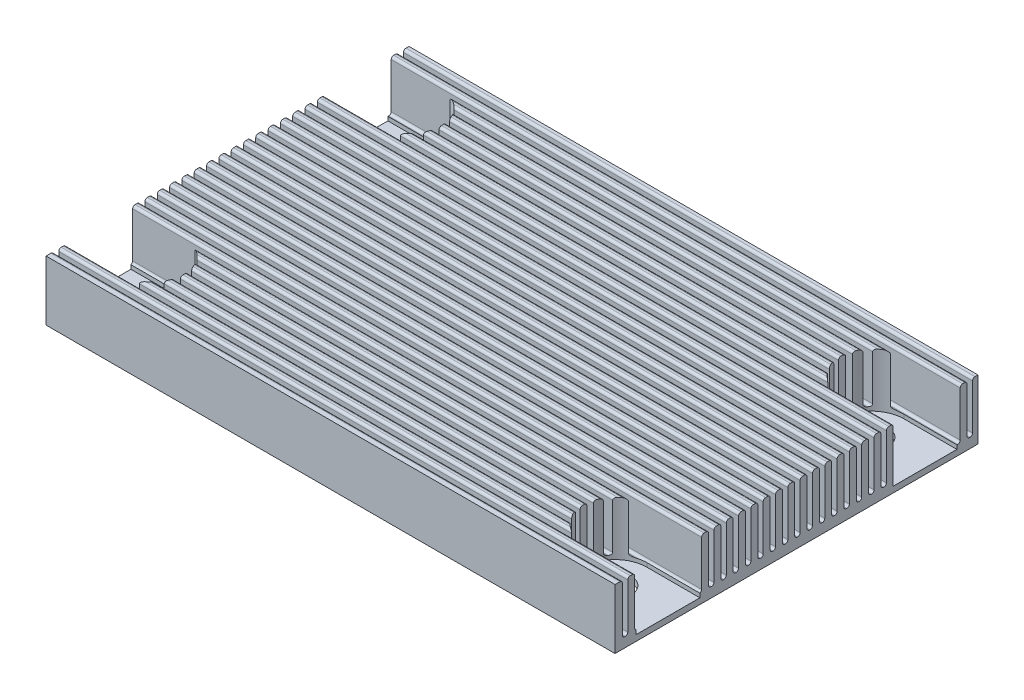
from build123d import *

# Parameters (mm, degrees)
SKETCH1_W           = 58
SKETCH1_H           = 37
SKETCH1_R           = 1.65
BOSS_EXTRUDE1_DEPTH = 6.1
CUT_EXTRUDE1_DEPTH  = 62.183821391
CUT_EXTRUDE3_START  = -5.5
SKETCH3_R           = 3.25
CUT_EXTRUDE3_DEPTH  = 5.5


with BuildPart() as part:
    # Sketch1 → Boss-Extrude1 (new body)
    with BuildSketch(Plane(origin=(0, 0, 0), x_dir=(1, 0, 0), z_dir=(0, 1, 0))):
        Rectangle(SKETCH1_W, SKETCH1_H)
        with Locations(Location((-23.6, 13.1, 0), (0, 0, 270))):
            Circle(SKETCH1_R, mode=Mode.SUBTRACT)
        with Locations(Location((-23.6, -13.1, 0), (0, 0, 270))):
            Circle(SKETCH1_R, mode=Mode.SUBTRACT)
        with Locations(Location((23.6, -13.1, 0), (0, 0, 270))):
            Circle(SKETCH1_R, mode=Mode.SUBTRACT)
        with Locations(Location((23.6, 13.1, 0), (0, 0, 270))):
            Circle(SKETCH1_R, mode=Mode.SUBTRACT)
    extrude(amount=BOSS_EXTRUDE1_DEPTH)

    # Sketch2 → Cut-Extrude1 (cut, through all)
    with BuildSketch(Plane(origin=(29, 0, 0), x_dir=(0, 0, -1), z_dir=(1, 0, 0))):
        with BuildLine():
            Line((-11.68, 6.1), (-11.725, 6.1))
            ThreePointArc((-11.725, 6.1), (-11.548223305, 6.026776695), (-11.475, 5.85))
            Line((-11.475, 5.85), (-11.475, 1.25))
            ThreePointArc((-11.475, 1.25), (-11.401776695, 1.073223305), (-11.225, 1))
            Line((-11.225, 1), (-11.175, 1))
            ThreePointArc((-11.175, 1), (-10.998223305, 1.073223305), (-10.925, 1.25))
            Line((-10.925, 1.25), (-10.925, 5.85))
            ThreePointArc((-10.925, 5.85), (-10.851776695, 6.026776695), (-10.675, 6.1))
            Line((-10.675, 6.1), (-11.68, 6.1))
        make_face()
        with BuildLine():
            Line((-10.425, 6.1), (-10.47, 6.1))
            ThreePointArc((-10.47, 6.1), (-10.293223305, 6.026776695), (-10.22, 5.85))
            Line((-10.22, 5.85), (-10.22, 1.25))
            ThreePointArc((-10.22, 1.25), (-10.146776695, 1.073223305), (-9.97, 1))
            Line((-9.97, 1), (-9.92, 1))
            ThreePointArc((-9.92, 1), (-9.743223305, 1.073223305), (-9.67, 1.25))
            Line((-9.67, 1.25), (-9.67, 5.85))
            ThreePointArc((-9.67, 5.85), (-9.596776695, 6.026776695), (-9.42, 6.1))
            Line((-9.42, 6.1), (-10.425, 6.1))
        make_face()
        with BuildLine():
            Line((-9.17, 6.1), (-9.215, 6.1))
            ThreePointArc((-9.215, 6.1), (-9.038223305, 6.026776695), (-8.965, 5.85))
            Line((-8.965, 5.85), (-8.965, 1.25))
            ThreePointArc((-8.965, 1.25), (-8.891776695, 1.073223305), (-8.715, 1))
            Line((-8.715, 1), (-8.665, 1))
            ThreePointArc((-8.665, 1), (-8.488223305, 1.073223305), (-8.415, 1.25))
            Line((-8.415, 1.25), (-8.415, 5.85))
            ThreePointArc((-8.415, 5.85), (-8.341776695, 6.026776695), (-8.165, 6.1))
            Line((-8.165, 6.1), (-9.17, 6.1))
        make_face()
        with BuildLine():
            Line((-7.915, 6.1), (-7.96, 6.1))
            ThreePointArc((-7.96, 6.1), (-7.783223305, 6.026776695), (-7.71, 5.85))
            Line((-7.71, 5.85), (-7.71, 1.25))
            ThreePointArc((-7.71, 1.25), (-7.636776695, 1.073223305), (-7.46, 1))
            Line((-7.46, 1), (-7.41, 1))
            ThreePointArc((-7.41, 1), (-7.233223305, 1.073223305), (-7.16, 1.25))
            Line((-7.16, 1.25), (-7.16, 5.85))
            ThreePointArc((-7.16, 5.85), (-7.086776695, 6.026776695), (-6.91, 6.1))
            Line((-6.91, 6.1), (-7.915, 6.1))
        make_face()
        with BuildLine():
            Line((-6.66, 6.1), (-6.705, 6.1))
            ThreePointArc((-6.705, 6.1), (-6.528223305, 6.026776695), (-6.455, 5.85))
            Line((-6.455, 5.85), (-6.455, 1.25))
            ThreePointArc((-6.455, 1.25), (-6.381776695, 1.073223305), (-6.205, 1))
            Line((-6.205, 1), (-6.155, 1))
            ThreePointArc((-6.155, 1), (-5.978223305, 1.073223305), (-5.905, 1.25))
            Line((-5.905, 1.25), (-5.905, 5.85))
            ThreePointArc((-5.905, 5.85), (-5.831776695, 6.026776695), (-5.655, 6.1))
            Line((-5.655, 6.1), (-6.66, 6.1))
        make_face()
        with BuildLine():
            Line((-12.935, 6.1), (-12.98, 6.1))
            ThreePointArc((-12.98, 6.1), (-12.803223305, 6.026776695), (-12.73, 5.85))
            Line((-12.73, 5.85), (-12.73, 1.25))
            ThreePointArc((-12.73, 1.25), (-12.656776695, 1.073223305), (-12.48, 1))
            Line((-12.48, 1), (-12.43, 1))
            ThreePointArc((-12.43, 1), (-12.253223305, 1.073223305), (-12.18, 1.25))
            Line((-12.18, 1.25), (-12.18, 5.85))
            ThreePointArc((-12.18, 5.85), (-12.106776695, 6.026776695), (-11.93, 6.1))
            Line((-11.93, 6.1), (-12.935, 6.1))
        make_face()
        with BuildLine():
            Line((-14.19, 6.1), (-14.235, 6.1))
            ThreePointArc((-14.235, 6.1), (-14.058223305, 6.026776695), (-13.985, 5.85))
            Line((-13.985, 5.85), (-13.985, 1.25))
            ThreePointArc((-13.985, 1.25), (-13.911776695, 1.073223305), (-13.735, 1))
            Line((-13.735, 1), (-13.685, 1))
            ThreePointArc((-13.685, 1), (-13.508223305, 1.073223305), (-13.435, 1.25))
            Line((-13.435, 1.25), (-13.435, 5.85))
            ThreePointArc((-13.435, 5.85), (-13.361776695, 6.026776695), (-13.185, 6.1))
            Line((-13.185, 6.1), (-14.19, 6.1))
        make_face()
        with BuildLine():
            Line((-15.445, 6.1), (-15.49, 6.1))
            ThreePointArc((-15.49, 6.1), (-15.313223305, 6.026776695), (-15.24, 5.85))
            Line((-15.24, 5.85), (-15.24, 1.25))
            ThreePointArc((-15.24, 1.25), (-15.166776695, 1.073223305), (-14.99, 1))
            Line((-14.99, 1), (-14.94, 1))
            ThreePointArc((-14.94, 1), (-14.763223305, 1.073223305), (-14.69, 1.25))
            Line((-14.69, 1.25), (-14.69, 5.85))
            ThreePointArc((-14.69, 5.85), (-14.616776695, 6.026776695), (-14.44, 6.1))
            Line((-14.44, 6.1), (-15.445, 6.1))
        make_face()
        with BuildLine():
            ThreePointArc((-16.745, 6.1), (-16.568223305, 6.026776695), (-16.495, 5.85))
            Line((-16.495, 5.85), (-16.495, 1.25))
            ThreePointArc((-16.495, 1.25), (-16.421776695, 1.073223305), (-16.245, 1))
            Line((-16.245, 1), (-16.195, 1))
            ThreePointArc((-16.195, 1), (-16.018223305, 1.073223305), (-15.945, 1.25))
            Line((-15.945, 1.25), (-15.945, 5.85))
            ThreePointArc((-15.945, 5.85), (-15.871776695, 6.026776695), (-15.695, 6.1))
            Line((-15.695, 6.1), (-16.7, 6.1))
            Line((-16.7, 6.1), (-16.745, 6.1))
        make_face()
        with BuildLine():
            Line((-17.2, 5.85), (-17.75, 5.85))
            Line((-17.75, 5.85), (-17.75, 1.25))
            ThreePointArc((-17.75, 1.25), (-17.676776695, 1.073223305), (-17.5, 1))
            Line((-17.5, 1), (-17.45, 1))
            ThreePointArc((-17.45, 1), (-17.273223305, 1.073223305), (-17.2, 1.25))
            Line((-17.2, 1.25), (-17.2, 5.85))
        make_face()
        with BuildLine():
            ThreePointArc((-18, 6.1), (-17.823223305, 6.026776695), (-17.75, 5.85))
            Line((-17.75, 5.85), (-17.2, 5.85))
            ThreePointArc((-17.2, 5.85), (-17.126776695, 6.026776695), (-16.95, 6.1))
            Line((-16.95, 6.1), (-18, 6.1))
        make_face()
        with BuildLine():
            Line((-5.405, 6.1), (-5.45, 6.1))
            ThreePointArc((-5.45, 6.1), (-5.273223305, 6.026776695), (-5.2, 5.85))
            Line((-5.2, 5.85), (-5.2, 1.25))
            ThreePointArc((-5.2, 1.25), (-5.126776695, 1.073223305), (-4.95, 1))
            Line((-4.95, 1), (-4.9, 1))
            ThreePointArc((-4.9, 1), (-4.723223305, 1.073223305), (-4.65, 1.25))
            Line((-4.65, 1.25), (-4.65, 5.85))
            ThreePointArc((-4.65, 5.85), (-4.576776695, 6.026776695), (-4.4, 6.1))
            Line((-4.4, 6.1), (-5.405, 6.1))
        make_face()
        with BuildLine():
            Line((-4.15, 6.1), (-4.195, 6.1))
            ThreePointArc((-4.195, 6.1), (-4.018223305, 6.026776695), (-3.945, 5.85))
            Line((-3.945, 5.85), (-3.945, 1.25))
            ThreePointArc((-3.945, 1.25), (-3.871776695, 1.073223305), (-3.695, 1))
            Line((-3.695, 1), (-3.645, 1))
            ThreePointArc((-3.645, 1), (-3.468223305, 1.073223305), (-3.395, 1.25))
            Line((-3.395, 1.25), (-3.395, 5.85))
            ThreePointArc((-3.395, 5.85), (-3.321776695, 6.026776695), (-3.145, 6.1))
            Line((-3.145, 6.1), (-4.15, 6.1))
        make_face()
        with BuildLine():
            Line((-2.895, 6.1), (-2.94, 6.1))
            ThreePointArc((-2.94, 6.1), (-2.763223305, 6.026776695), (-2.69, 5.85))
            Line((-2.69, 5.85), (-2.69, 1.25))
            ThreePointArc((-2.69, 1.25), (-2.616776695, 1.073223305), (-2.44, 1))
            Line((-2.44, 1), (-2.39, 1))
            ThreePointArc((-2.39, 1), (-2.213223305, 1.073223305), (-2.14, 1.25))
            Line((-2.14, 1.25), (-2.14, 5.85))
            ThreePointArc((-2.14, 5.85), (-2.066776695, 6.026776695), (-1.89, 6.1))
            Line((-1.89, 6.1), (-2.895, 6.1))
        make_face()
        with BuildLine():
            Line((-1.64, 6.1), (-1.685, 6.1))
            ThreePointArc((-1.685, 6.1), (-1.508223305, 6.026776695), (-1.435, 5.85))
            Line((-1.435, 5.85), (-1.435, 1.25))
            ThreePointArc((-1.435, 1.25), (-1.361776695, 1.073223305), (-1.185, 1))
            Line((-1.185, 1), (-1.135, 1))
            ThreePointArc((-1.135, 1), (-0.958223305, 1.073223305), (-0.885, 1.25))
            Line((-0.885, 1.25), (-0.885, 5.85))
            ThreePointArc((-0.885, 5.85), (-0.811776695, 6.026776695), (-0.635, 6.1))
            Line((-0.635, 6.1), (-1.64, 6.1))
        make_face()
        with BuildLine():
            Line((-0.385, 6.1), (-0.43, 6.1))
            ThreePointArc((-0.43, 6.1), (-0.253223305, 6.026776695), (-0.18, 5.85))
            Line((-0.18, 5.85), (-0.18, 1.25))
            ThreePointArc((-0.18, 1.25), (-0.106776695, 1.073223305), (0.07, 1))
            Line((0.07, 1), (0.12, 1))
            ThreePointArc((0.12, 1), (0.296776695, 1.073223305), (0.37, 1.25))
            Line((0.37, 1.25), (0.37, 5.85))
            ThreePointArc((0.37, 5.85), (0.443223305, 6.026776695), (0.62, 6.1))
            Line((0.62, 6.1), (-0.385, 6.1))
        make_face()
        with BuildLine():
            Line((0.87, 6.1), (0.825, 6.1))
            ThreePointArc((0.825, 6.1), (1.001776695, 6.026776695), (1.075, 5.85))
            Line((1.075, 5.85), (1.075, 1.25))
            ThreePointArc((1.075, 1.25), (1.148223305, 1.073223305), (1.325, 1))
            Line((1.325, 1), (1.375, 1))
            ThreePointArc((1.375, 1), (1.551776695, 1.073223305), (1.625, 1.25))
            Line((1.625, 1.25), (1.625, 5.85))
            ThreePointArc((1.625, 5.85), (1.698223305, 6.026776695), (1.875, 6.1))
            Line((1.875, 6.1), (0.87, 6.1))
        make_face()
        with BuildLine():
            ThreePointArc((2.88, 5.85), (2.953223305, 6.026776695), (3.13, 6.1))
            Line((3.13, 6.1), (2.125, 6.1))
            Line((2.125, 6.1), (2.08, 6.1))
            ThreePointArc((2.08, 6.1), (2.256776695, 6.026776695), (2.33, 5.85))
            Line((2.33, 5.85), (2.33, 1.25))
            ThreePointArc((2.33, 1.25), (2.403223305, 1.073223305), (2.58, 1))
            Line((2.58, 1), (2.63, 1))
            ThreePointArc((2.63, 1), (2.806776695, 1.073223305), (2.88, 1.25))
            Line((2.88, 1.25), (2.88, 5.85))
        make_face()
        with BuildLine():
            ThreePointArc((4.135, 5.85), (4.208223305, 6.026776695), (4.385, 6.1))
            Line((4.385, 6.1), (3.38, 6.1))
            Line((3.38, 6.1), (3.335, 6.1))
            ThreePointArc((3.335, 6.1), (3.511776695, 6.026776695), (3.585, 5.85))
            Line((3.585, 5.85), (3.585, 1.25))
            ThreePointArc((3.585, 1.25), (3.658223305, 1.073223305), (3.835, 1))
            Line((3.835, 1), (3.885, 1))
            ThreePointArc((3.885, 1), (4.061776695, 1.073223305), (4.135, 1.25))
            Line((4.135, 1.25), (4.135, 5.85))
        make_face()
        with BuildLine():
            ThreePointArc((5.39, 5.85), (5.463223305, 6.026776695), (5.64, 6.1))
            Line((5.64, 6.1), (4.635, 6.1))
            Line((4.635, 6.1), (4.59, 6.1))
            ThreePointArc((4.59, 6.1), (4.766776695, 6.026776695), (4.84, 5.85))
            Line((4.84, 5.85), (4.84, 1.25))
            ThreePointArc((4.84, 1.25), (4.913223305, 1.073223305), (5.09, 1))
            Line((5.09, 1), (5.14, 1))
            ThreePointArc((5.14, 1), (5.316776695, 1.073223305), (5.39, 1.25))
            Line((5.39, 1.25), (5.39, 5.85))
        make_face()
        with BuildLine():
            ThreePointArc((6.645, 5.85), (6.718223305, 6.026776695), (6.895, 6.1))
            Line((6.895, 6.1), (5.89, 6.1))
            Line((5.89, 6.1), (5.845, 6.1))
            ThreePointArc((5.845, 6.1), (6.021776695, 6.026776695), (6.095, 5.85))
            Line((6.095, 5.85), (6.095, 1.25))
            ThreePointArc((6.095, 1.25), (6.168223305, 1.073223305), (6.345, 1))
            Line((6.345, 1), (6.395, 1))
            ThreePointArc((6.395, 1), (6.571776695, 1.073223305), (6.645, 1.25))
            Line((6.645, 1.25), (6.645, 5.85))
        make_face()
        with BuildLine():
            ThreePointArc((7.9, 5.85), (7.973223305, 6.026776695), (8.15, 6.1))
            Line((8.15, 6.1), (7.145, 6.1))
            Line((7.145, 6.1), (7.1, 6.1))
            ThreePointArc((7.1, 6.1), (7.276776695, 6.026776695), (7.35, 5.85))
            Line((7.35, 5.85), (7.35, 1.25))
            ThreePointArc((7.35, 1.25), (7.423223305, 1.073223305), (7.6, 1))
            Line((7.6, 1), (7.65, 1))
            ThreePointArc((7.65, 1), (7.826776695, 1.073223305), (7.9, 1.25))
            Line((7.9, 1.25), (7.9, 5.85))
        make_face()
        with BuildLine():
            ThreePointArc((9.155, 5.85), (9.228223305, 6.026776695), (9.405, 6.1))
            Line((9.405, 6.1), (8.4, 6.1))
            Line((8.4, 6.1), (8.355, 6.1))
            ThreePointArc((8.355, 6.1), (8.531776695, 6.026776695), (8.605, 5.85))
            Line((8.605, 5.85), (8.605, 1.25))
            ThreePointArc((8.605, 1.25), (8.678223305, 1.073223305), (8.855, 1))
            Line((8.855, 1), (8.905, 1))
            ThreePointArc((8.905, 1), (9.081776695, 1.073223305), (9.155, 1.25))
            Line((9.155, 1.25), (9.155, 5.85))
        make_face()
        with BuildLine():
            ThreePointArc((10.41, 5.85), (10.483223305, 6.026776695), (10.66, 6.1))
            Line((10.66, 6.1), (9.655, 6.1))
            Line((9.655, 6.1), (9.61, 6.1))
            ThreePointArc((9.61, 6.1), (9.786776695, 6.026776695), (9.86, 5.85))
            Line((9.86, 5.85), (9.86, 1.25))
            ThreePointArc((9.86, 1.25), (9.933223305, 1.073223305), (10.11, 1))
            Line((10.11, 1), (10.16, 1))
            ThreePointArc((10.16, 1), (10.336776695, 1.073223305), (10.41, 1.25))
            Line((10.41, 1.25), (10.41, 5.85))
        make_face()
        with BuildLine():
            ThreePointArc((11.665, 5.85), (11.738223305, 6.026776695), (11.915, 6.1))
            Line((11.915, 6.1), (10.91, 6.1))
            Line((10.91, 6.1), (10.865, 6.1))
            ThreePointArc((10.865, 6.1), (11.041776695, 6.026776695), (11.115, 5.85))
            Line((11.115, 5.85), (11.115, 1.25))
            ThreePointArc((11.115, 1.25), (11.188223305, 1.073223305), (11.365, 1))
            Line((11.365, 1), (11.415, 1))
            ThreePointArc((11.415, 1), (11.591776695, 1.073223305), (11.665, 1.25))
            Line((11.665, 1.25), (11.665, 5.85))
        make_face()
        with BuildLine():
            ThreePointArc((12.92, 5.85), (12.993223305, 6.026776695), (13.17, 6.1))
            Line((13.17, 6.1), (12.165, 6.1))
            Line((12.165, 6.1), (12.12, 6.1))
            ThreePointArc((12.12, 6.1), (12.296776695, 6.026776695), (12.37, 5.85))
            Line((12.37, 5.85), (12.37, 1.25))
            ThreePointArc((12.37, 1.25), (12.443223305, 1.073223305), (12.62, 1))
            Line((12.62, 1), (12.67, 1))
            ThreePointArc((12.67, 1), (12.846776695, 1.073223305), (12.92, 1.25))
            Line((12.92, 1.25), (12.92, 5.85))
        make_face()
        with BuildLine():
            ThreePointArc((14.175, 5.85), (14.248223305, 6.026776695), (14.425, 6.1))
            Line((14.425, 6.1), (13.42, 6.1))
            Line((13.42, 6.1), (13.375, 6.1))
            ThreePointArc((13.375, 6.1), (13.551776695, 6.026776695), (13.625, 5.85))
            Line((13.625, 5.85), (13.625, 1.25))
            ThreePointArc((13.625, 1.25), (13.698223305, 1.073223305), (13.875, 1))
            Line((13.875, 1), (13.925, 1))
            ThreePointArc((13.925, 1), (14.101776695, 1.073223305), (14.175, 1.25))
            Line((14.175, 1.25), (14.175, 5.85))
        make_face()
        with BuildLine():
            ThreePointArc((15.43, 5.85), (15.503223305, 6.026776695), (15.68, 6.1))
            Line((15.68, 6.1), (14.675, 6.1))
            Line((14.675, 6.1), (14.63, 6.1))
            ThreePointArc((14.63, 6.1), (14.806776695, 6.026776695), (14.88, 5.85))
            Line((14.88, 5.85), (14.88, 1.25))
            ThreePointArc((14.88, 1.25), (14.953223305, 1.073223305), (15.13, 1))
            Line((15.13, 1), (15.18, 1))
            ThreePointArc((15.18, 1), (15.356776695, 1.073223305), (15.43, 1.25))
            Line((15.43, 1.25), (15.43, 5.85))
        make_face()
        with BuildLine():
            ThreePointArc((16.685, 5.85), (16.758223305, 6.026776695), (16.935, 6.1))
            Line((16.935, 6.1), (15.93, 6.1))
            Line((15.93, 6.1), (15.885, 6.1))
            ThreePointArc((15.885, 6.1), (16.061776695, 6.026776695), (16.135, 5.85))
            Line((16.135, 5.85), (16.135, 1.25))
            ThreePointArc((16.135, 1.25), (16.208223305, 1.073223305), (16.385, 1))
            Line((16.385, 1), (16.435, 1))
            ThreePointArc((16.435, 1), (16.611776695, 1.073223305), (16.685, 1.25))
            Line((16.685, 1.25), (16.685, 5.85))
        make_face()
        with BuildLine():
            ThreePointArc((17.94, 5.85), (18.013223305, 6.026776695), (18.19, 6.1))
            Line((18.19, 6.1), (17.185, 6.1))
            Line((17.185, 6.1), (17.14, 6.1))
            ThreePointArc((17.14, 6.1), (17.316776695, 6.026776695), (17.39, 5.85))
            Line((17.39, 5.85), (17.39, 1.25))
            ThreePointArc((17.39, 1.25), (17.463223305, 1.073223305), (17.64, 1))
            Line((17.64, 1), (17.69, 1))
            ThreePointArc((17.69, 1), (17.866776695, 1.073223305), (17.94, 1.25))
            Line((17.94, 1.25), (17.94, 5.85))
        make_face()
    extrude(amount=-CUT_EXTRUDE1_DEPTH, mode=Mode.SUBTRACT)

    # Sketch3 → Cut-Extrude3 (cut)
    with BuildSketch(Plane(origin=(0, 6.1, 0), x_dir=(1, 0, 0), z_dir=(0, 1, 0)).offset(CUT_EXTRUDE3_START)):
        with BuildLine():
            Line((-26.56763795, 14.425), (-29, 14.425))
            Line((-29, 14.425), (-29, 9.85))
            Line((-29, 9.85), (-23.6, 9.85))
            ThreePointArc((-23.6, 9.85), (-26.326605032, 11.331349384), (-26.56763795, 14.425))
        make_face()
        with BuildLine():
            Line((-23.6, 16.35), (-29, 16.35))
            Line((-29, 16.35), (-29, 14.63))
            Line((-29, 14.63), (-26.467333256, 14.63))
            ThreePointArc((-26.467333256, 14.63), (-25.27182535, 15.887023502), (-23.6, 16.35))
        make_face()
        with BuildLine():
            ThreePointArc((-20.35, 13.1), (-21.301902961, 15.398097039), (-23.6, 16.35))
            ThreePointArc((-23.6, 16.35), (-25.27182535, 15.887023502), (-26.467333256, 14.63))
            Line((-26.467333256, 14.63), (-24.217737808, 14.63))
            ThreePointArc((-24.217737808, 14.63), (-24.407053395, 14.539154202), (-24.583298022, 14.425))
            Line((-24.583298022, 14.425), (-26.56763795, 14.425))
            ThreePointArc((-26.56763795, 14.425), (-26.326605032, 11.331349384), (-23.6, 9.85))
            ThreePointArc((-23.6, 9.85), (-21.301902961, 10.801902961), (-20.35, 13.1))
        make_face()
        with BuildLine():
            Line((-24.217737808, 14.63), (-26.467333256, 14.63))
            ThreePointArc((-26.467333256, 14.63), (-26.519285613, 14.528380729), (-26.56763795, 14.425))
            Line((-26.56763795, 14.425), (-24.583298022, 14.425))
            ThreePointArc((-24.583298022, 14.425), (-24.407053395, 14.539154202), (-24.217737808, 14.63))
        make_face()
        with Locations((-23.6, -13.1)):
            Circle(SKETCH3_R)
        with BuildLine():
            ThreePointArc((-23.6, -16.35), (-26.85, -13.1), (-23.6, -9.85))
            Line((-23.6, -9.85), (-29, -9.85))
            Line((-29, -9.85), (-29, -16.35))
            Line((-29, -16.35), (-23.6, -16.35))
        make_face()
        with Locations((23.6, -13.1)):
            Circle(SKETCH3_R)
        with BuildLine():
            Line((23.6, -16.35), (29, -16.35))
            Line((29, -16.35), (29, -9.85))
            Line((29, -9.85), (23.6, -9.85))
            ThreePointArc((23.6, -9.85), (25.898097039, -10.801902961), (26.85, -13.1))
            ThreePointArc((26.85, -13.1), (25.898097039, -15.398097039), (23.6, -16.35))
        make_face()
        with BuildLine():
            Line((29, 16.35), (23.6, 16.35))
            ThreePointArc((23.6, 16.35), (25.898097039, 15.398097039), (26.85, 13.1))
            ThreePointArc((26.85, 13.1), (25.898097039, 10.801902961), (23.6, 9.85))
            Line((23.6, 9.85), (29, 9.85))
            Line((29, 9.85), (29, 16.35))
        make_face()
        with Locations((23.6, 13.1)):
            Circle(SKETCH3_R)
        with BuildLine():
            Line((-26.467333256, 14.63), (-29, 14.63))
            Line((-29, 14.63), (-29, 14.425))
            Line((-29, 14.425), (-26.56763795, 14.425))
            ThreePointArc((-26.56763795, 14.425), (-26.519285613, 14.528380729), (-26.467333256, 14.63))
        make_face()
    extrude(amount=CUT_EXTRUDE3_DEPTH, mode=Mode.SUBTRACT)


solid = part.part
